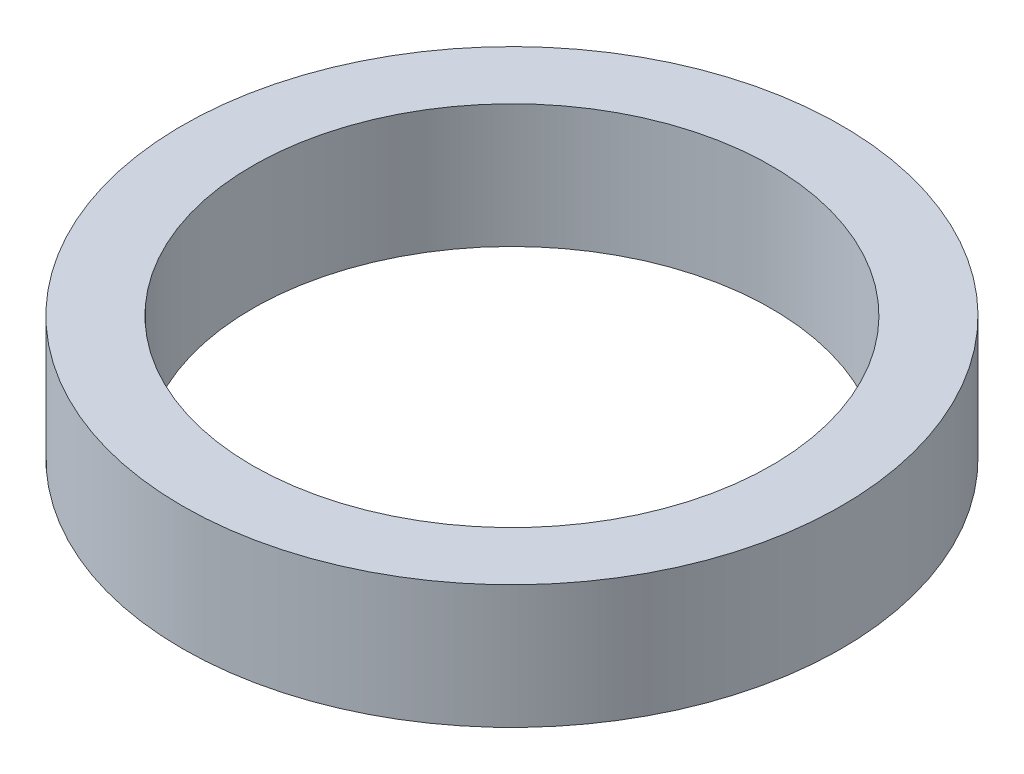
from build123d import *

# Parameters (mm, degrees)
SKETCH1_R           = 4
SKETCH1_R_2         = 3.15
BOSS_EXTRUDE1_DEPTH = 1.5


with BuildPart() as part:
    # Sketch1 → Boss-Extrude1 (new body)
    with BuildSketch(Plane(origin=(0, 0, 0), x_dir=(1, 0, 0), z_dir=(0, 1, 0))):
        with Locations(Location((0, 0, 0), (0, 0, 270))):
            Circle(SKETCH1_R)
        with Locations(Location((0, 0, 0), (0, 0, 270))):
            Circle(SKETCH1_R_2, mode=Mode.SUBTRACT)
    extrude(amount=BOSS_EXTRUDE1_DEPTH)


solid = part.part
